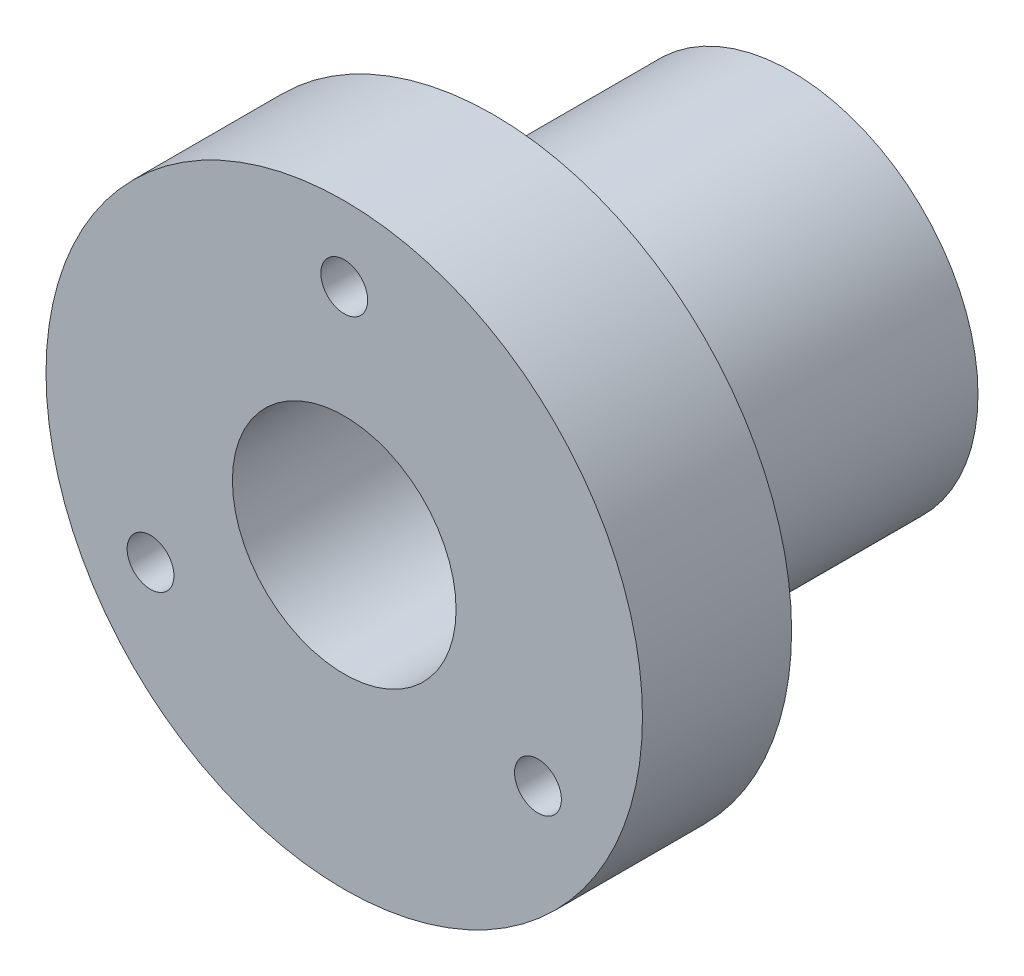
from build123d import *

# Parameters (mm, degrees)
SKETCH1_R                       = 25.4
BOSS_EXTRUDE1_DEPTH             = 12.7
SKETCH9_R                       = 15.875
BOSS_EXTRUDE2_DEPTH             = 38.1
F_10_24_TAPPED_HOLE1_D          = 3.9878
F_8_4_8_4_DIAMETER_HOLE2_D      = 8.4
F_10_0_10_DIAMETER_HOLE1_D      = 10
F_10_0_10_DIAMETER_HOLE1_DEPTH  = 10.16
F_10_0_10_DIAMETER_HOLE1_TIP    = 3.004303095
F_3_4_0_75_DIAMETER_HOLE1_D     = 19.05
F_3_4_0_75_DIAMETER_HOLE1_DEPTH = 22.86


with BuildPart() as part:
    # Sketch1 → Boss-Extrude1 (new body)
    with BuildSketch(Plane.XY):
        Circle(SKETCH1_R)
    extrude(amount=-BOSS_EXTRUDE1_DEPTH)

    # Sketch9 → Boss-Extrude2 (add)
    with BuildSketch(Plane.XY):
        Circle(SKETCH9_R)
    extrude(amount=-BOSS_EXTRUDE2_DEPTH)

    # #10-24 Tapped Hole1 (through all)
    with Locations(Plane(origin=(0, 0, -12.7), x_dir=(-1, 0, 0), z_dir=(0, 0, -1))):
        with Locations((0, 19.05), (-16.497783942, -9.525), (16.497783942, -9.525)):
            Hole(F_10_24_TAPPED_HOLE1_D / 2)

    # Ø8.4 (8.4) Diameter Hole2 (through all)
    with Locations(Plane(origin=(0, 0, -38.1), x_dir=(-1, 0, 0), z_dir=(0, 0, -1))):
        with Locations((0, 0)):
            Hole(F_8_4_8_4_DIAMETER_HOLE2_D / 2)

    # Ø10.0 (10) Diameter Hole1
    with Locations(Plane(origin=(0, 0, -38.1), x_dir=(-1, 0, 0), z_dir=(0, 0, -1))):
        with Locations((0, 0)):
            Hole(F_10_0_10_DIAMETER_HOLE1_D / 2, depth=F_10_0_10_DIAMETER_HOLE1_DEPTH)
            with Locations((0, 0, -(F_10_0_10_DIAMETER_HOLE1_DEPTH + F_10_0_10_DIAMETER_HOLE1_TIP / 2))):  # 118° drill point
                Cone(0, F_10_0_10_DIAMETER_HOLE1_D / 2, F_10_0_10_DIAMETER_HOLE1_TIP, mode=Mode.SUBTRACT)

    # 3/4 (0.75) Diameter Hole1
    with Locations(Plane.XY):
        with Locations((0, 0)):
            Hole(F_3_4_0_75_DIAMETER_HOLE1_D / 2, depth=F_3_4_0_75_DIAMETER_HOLE1_DEPTH)


solid = part.part
